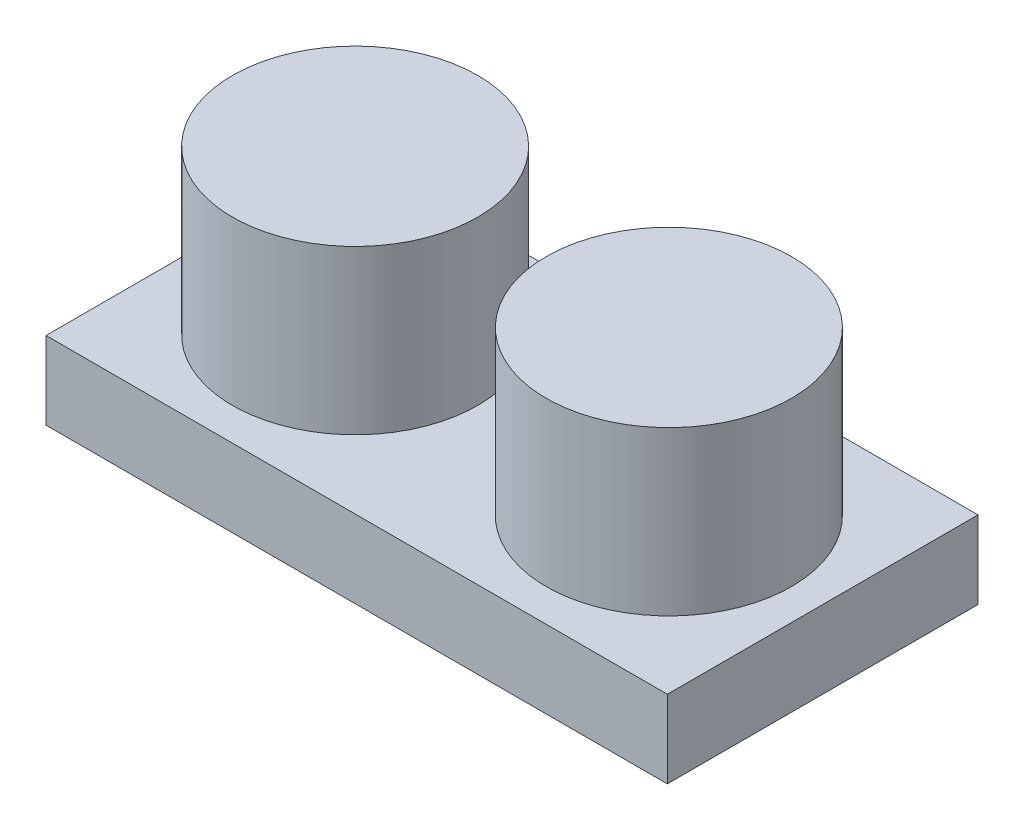
from build123d import *

# Parameters (mm, degrees)
SKETCH1_W           = 40
SKETCH1_H           = 20
BOSS_EXTRUDE1_DEPTH = 5
SKETCH2_R           = 7.9
BOSS_EXTRUDE2_DEPTH = 10.5


with BuildPart() as part:
    # Sketch1 → Boss-Extrude1 (new body)
    with BuildSketch(Plane(origin=(0, 0, 0), x_dir=(1, 0, 0), z_dir=(0, 1, 0))):
        Rectangle(SKETCH1_W, SKETCH1_H)
    extrude(amount=BOSS_EXTRUDE1_DEPTH)

    # Sketch2 → Boss-Extrude2 (add)
    with BuildSketch(Plane(origin=(0, 5, 0), x_dir=(1, 0, 0), z_dir=(0, 1, 0))):
        with Locations(Location((-10.1, 0, 0), (0, 0, 90))):
            Circle(SKETCH2_R)
        with Locations(Location((10.1, 0, 0), (0, 0, 90))):
            Circle(SKETCH2_R)
    extrude(amount=BOSS_EXTRUDE2_DEPTH)


solid = part.part
